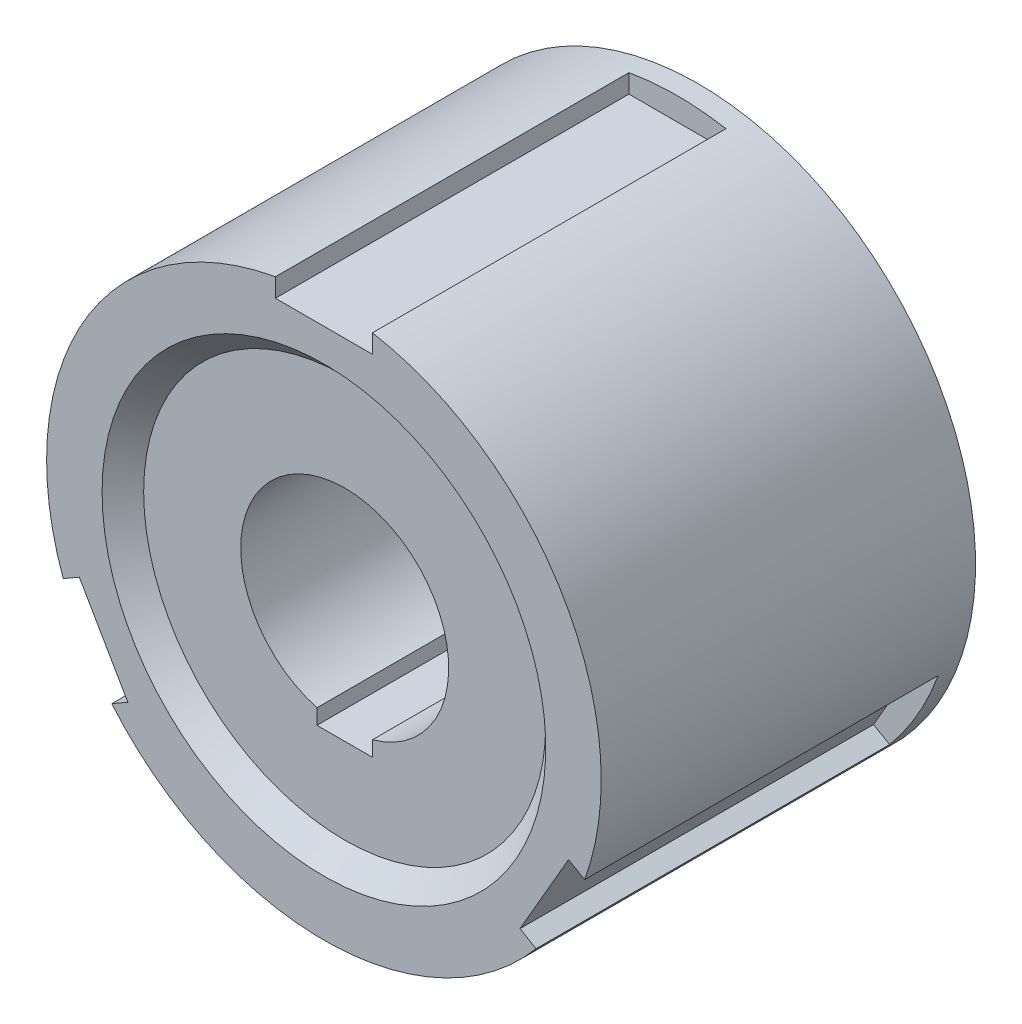
from build123d import *

# Parameters (mm, degrees)
ESQUISSE1_R             = 40
ESQUISSE1_R_2           = 33
ESQUISSE1_R_3           = 15
BOSS_EXTRU_1_DEPTH      = 58
ESQUISSE2_W             = 8
ESQUISSE2_H             = 3.3
ENL_V_MAT_EXTRU_1_DEPTH = 82.018516402
ENL_V_START             = -51
ENL_V_MAT_EXTRU_2_DEPTH = 51
ESQUISSE4_R             = 40
ESQUISSE4_R_2           = 33
ENL_V_MAT_EXTRU_3_DEPTH = 4


with BuildPart() as part:
    # Esquisse1 → Boss.-Extru.1 (new body)
    # profile 1 of 2: a face of its own
    with BuildSketch(Plane.XY):
        with Locations(Location((0, 0, 0), (0, 0, 180))):
            Circle(ESQUISSE1_R)
        Circle(ESQUISSE1_R_2, mode=Mode.SUBTRACT)
    # profile 2 of 2: a face of its own
    with BuildSketch(Plane.XY):
        Circle(ESQUISSE1_R_2)
        with Locations(Location((0, 0, 0), (0, 0, 180))):
            Circle(ESQUISSE1_R_3, mode=Mode.SUBTRACT)
    extrude(amount=BOSS_EXTRU_1_DEPTH)

    # Esquisse2 → Enlèv. mat.-Extru.1 (cut, through all)
    with BuildSketch(Plane.XY.offset(58)):
        with Locations((0, -15)):
            Rectangle(ESQUISSE2_W, ESQUISSE2_H)
    extrude(amount=-ENL_V_MAT_EXTRU_1_DEPTH, mode=Mode.SUBTRACT)

    # Esquisse3 → Enlèv. mat.-Extru.2 (cut)
    with BuildSketch(Plane.XY.offset(58).offset(ENL_V_START)):
        with BuildLine():
            Line((40.999452493, -15.588141165), (37.606451003, -13.629190841))
            ThreePointArc((37.606451003, -13.629190841), (34.641016151, -20), (30.606451003, -25.753546494))
            Line((30.606451003, -25.753546494), (33.999452493, -27.712496818))
            Line((33.999452493, -27.712496818), (40.999452493, -15.588141165))
        make_face()
        with BuildLine():
            ThreePointArc((30.606451003, -25.753546494), (34.641016151, -20), (37.606451003, -13.629190841))
            Line((37.606451003, -13.629190841), (35.28257981, -12.287503182))
            Line((35.28257981, -12.287503182), (28.28257981, -24.411858835))
            Line((28.28257981, -24.411858835), (30.606451003, -25.753546494))
        make_face()
        with BuildLine():
            ThreePointArc((-30.606451003, -25.753546494), (-34.641016151, -20), (-37.606451003, -13.629190841))
            Line((-37.606451003, -13.629190841), (-40.999452493, -15.588141165))
            Line((-40.999452493, -15.588141165), (-33.999452493, -27.712496818))
            Line((-33.999452493, -27.712496818), (-30.606451003, -25.753546494))
        make_face()
        with BuildLine():
            Line((-35.28257981, -12.287503182), (-37.606451003, -13.629190841))
            ThreePointArc((-37.606451003, -13.629190841), (-34.641016151, -20), (-30.606451003, -25.753546494))
            Line((-30.606451003, -25.753546494), (-28.28257981, -24.411858835))
            Line((-28.28257981, -24.411858835), (-35.28257981, -12.287503182))
        make_face()
        with BuildLine():
            ThreePointArc((7, 39.382737335), (0, 40), (-7, 39.382737335))
            Line((-7, 39.382737335), (-7, 36.699362017))
            Line((-7, 36.699362017), (7, 36.699362017))
            Line((7, 36.699362017), (7, 39.382737335))
        make_face()
        with BuildLine():
            Line((7, 43.300637983), (-7, 43.300637983))
            Line((-7, 43.300637983), (-7, 39.382737335))
            ThreePointArc((-7, 39.382737335), (0, 40), (7, 39.382737335))
            Line((7, 39.382737335), (7, 43.300637983))
        make_face()
    extrude(amount=ENL_V_MAT_EXTRU_2_DEPTH, mode=Mode.SUBTRACT)

    # Esquisse4 → Enlèv. mat.-Extru.3 (cut)
    with BuildSketch(Plane(origin=(0, 0, 0), x_dir=(-1, 0, 0), z_dir=(0, 0, -1))):
        Circle(ESQUISSE4_R)
        Circle(ESQUISSE4_R_2, mode=Mode.SUBTRACT)
    extrude(amount=-ENL_V_MAT_EXTRU_3_DEPTH, mode=Mode.SUBTRACT)

    # Esquisse7 → Enlèvement de matière-Révolution2 (revolve, cut)
    with BuildSketch(Plane(origin=(0, 0, 0), x_dir=(0, 0, -1), z_dir=(1, 0, 0)), mode=Mode.PRIVATE) as enl_vement_de_mati_re_r_volution2_sk:
        Polygon((-58, 32), (-55, 29), (-55, 0), (-58, 0), align=None)
    revolve(enl_vement_de_mati_re_r_volution2_sk.sketch.rotate(Axis((0, 0, 0), (0, 0, 1)), 90), axis=Axis((0, 0, 0), (0, 0, 1)), mode=Mode.SUBTRACT)


solid = part.part
